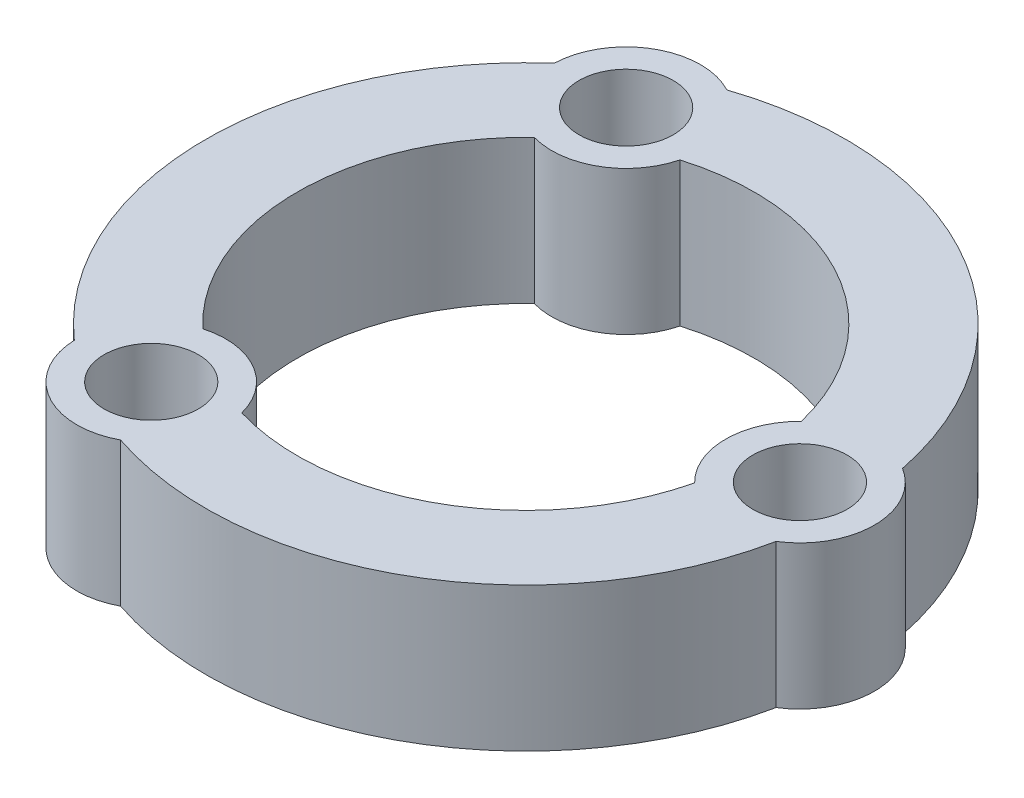
from build123d import *

# Parameters (mm, degrees)
SKETCH1_R           = 3.175
BOSS_EXTRUDE1_DEPTH = 10
SKETCH3_R           = 3.275
CUT_EXTRUDE1_DEPTH  = 7.5
CIRPATTERN1_COUNT   = 3


with BuildPart() as part:
    # Sketch1 → Boss-Extrude1 (new body)
    # profile 1 of 4: a face of its own
    with BuildSketch(Plane(origin=(0, 0, 0), x_dir=(1, 0, 0), z_dir=(0, 1, 0))):
        with BuildLine():
            ThreePointArc((-14.698323484, 16.673963027), (-22.2275, 0), (-14.698323484, -16.673963027))
            ThreePointArc((-14.698323484, -16.673963027), (-12.11375, -20.98163047), (-7.090913821, -21.066103043))
            ThreePointArc((-7.090913821, -21.066103043), (11.11375, -19.249579663), (21.789237305, -4.392140016))
            ThreePointArc((21.789237305, -4.392140016), (24.2275, 0), (21.789237305, 4.392140016))
            ThreePointArc((21.789237305, 4.392140016), (11.11375, 19.249579663), (-7.090913821, 21.066103043))
            ThreePointArc((-7.090913821, 21.066103043), (-12.11375, 20.98163047), (-14.698323484, 16.673963027))
        make_face()
        with Locations((-9.52625, 16.499949006)):
            Circle(SKETCH1_R, mode=Mode.SUBTRACT)
        with Locations((19.0525, 0)):
            Circle(SKETCH1_R, mode=Mode.SUBTRACT)
        with Locations((-9.52625, -16.499949006)):
            Circle(SKETCH1_R, mode=Mode.SUBTRACT)
        with BuildLine():
            ThreePointArc((-4.511236152, -15.223132222), (7.93875, -13.750318349), (15.439237305, -3.704721001))
            ThreePointArc((15.439237305, -3.704721001), (13.8775, 0), (15.439237305, 3.704721001))
            ThreePointArc((15.439237305, 3.704721001), (7.93875, 13.750318349), (-4.511236152, 15.223132222))
            ThreePointArc((-4.511236152, 15.223132222), (-6.93875, 12.018267541), (-10.928001153, 11.518411221))
            ThreePointArc((-10.928001153, 11.518411221), (-15.8775, 0), (-10.928001153, -11.518411221))
            ThreePointArc((-10.928001153, -11.518411221), (-6.93875, -12.018267541), (-4.511236152, -15.223132222))
        make_face(mode=Mode.SUBTRACT)
    # profile 2 of 4: a face of its own
    with BuildSketch(Plane(origin=(0, 0, 0), x_dir=(1, 0, 0), z_dir=(0, 1, 0))):
        with Locations((19.0525, 0)):
            Circle(SKETCH1_R)
    # profile 3 of 4: a face of its own
    with BuildSketch(Plane(origin=(0, 0, 0), x_dir=(1, 0, 0), z_dir=(0, 1, 0))):
        with Locations((-9.52625, 16.499949006)):
            Circle(SKETCH1_R)
    # profile 4 of 4: a face of its own
    with BuildSketch(Plane(origin=(0, 0, 0), x_dir=(1, 0, 0), z_dir=(0, 1, 0))):
        with Locations((-9.52625, -16.499949006)):
            Circle(SKETCH1_R)
    extrude(amount=BOSS_EXTRUDE1_DEPTH)

    # Sketch3 → Cut-Extrude1 (cut)
    with BuildSketch(Plane(origin=(0, 10, 0), x_dir=(1, 0, 0), z_dir=(0, 1, 0))):
        with Locations(Location((19.0525, 0, 0), (0, 0, 270))):
            Circle(SKETCH3_R)
    cut_extrude1 = extrude(amount=-CUT_EXTRUDE1_DEPTH, mode=Mode.SUBTRACT)

    # CirPattern1: Cut-Extrude1 ×3 about axis
    cirpattern1_axis = Axis((0, 0, 0), (0, 1, 0))
    for i in range(1, CIRPATTERN1_COUNT):
        add(cut_extrude1.rotate(cirpattern1_axis, i * 360 / CIRPATTERN1_COUNT), mode=Mode.SUBTRACT)


solid = part.part
